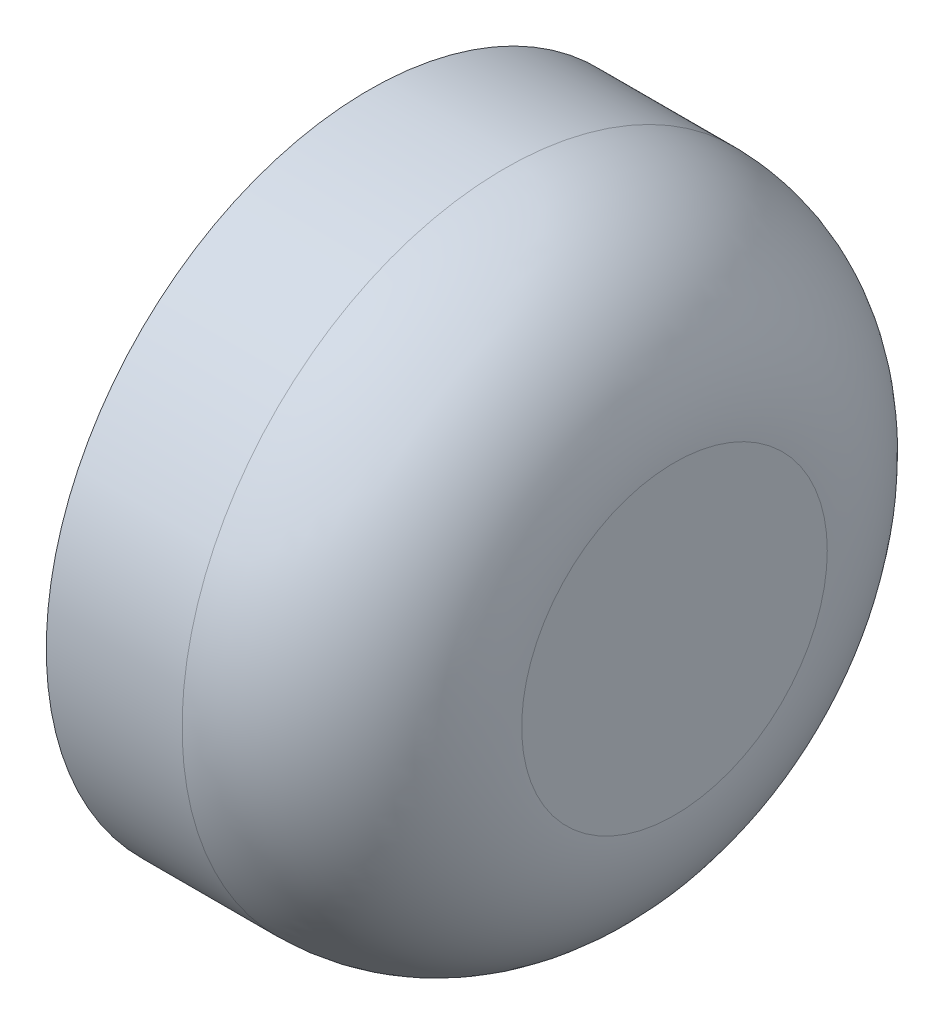
from build123d import *

# Parameters (mm, degrees)
SKETCH2_R           = 4.75
BOSS_EXTRUDE1_DEPTH = 4.5
FILLET1_R           = 2.5
SKETCH4_R           = 3.3
CUT_EXTRUDE1_DEPTH  = 1


with BuildPart() as part:
    # Sketch2 → Boss-Extrude1 (new body)
    with BuildSketch(Plane(origin=(0, -0.009014989, 6.9698e-05), x_dir=(0, 0, -1), z_dir=(1, 0, 0))):
        with Locations((0.107363595, 0.037450781)):
            Circle(SKETCH2_R)
    extrude(amount=BOSS_EXTRUDE1_DEPTH)

    # Fillet1
    fillet1_edges = [part.edges().sort_by_distance(p)[0] for p in [
        (4.5, 0.028435792, 4.642706103),
    ]]
    fillet(fillet1_edges, radius=FILLET1_R)

    # Sketch4 → Cut-Extrude1 (cut)
    with BuildSketch(Plane.ZY):
        Circle(SKETCH4_R)
    extrude(amount=-CUT_EXTRUDE1_DEPTH, mode=Mode.SUBTRACT)


solid = part.part
